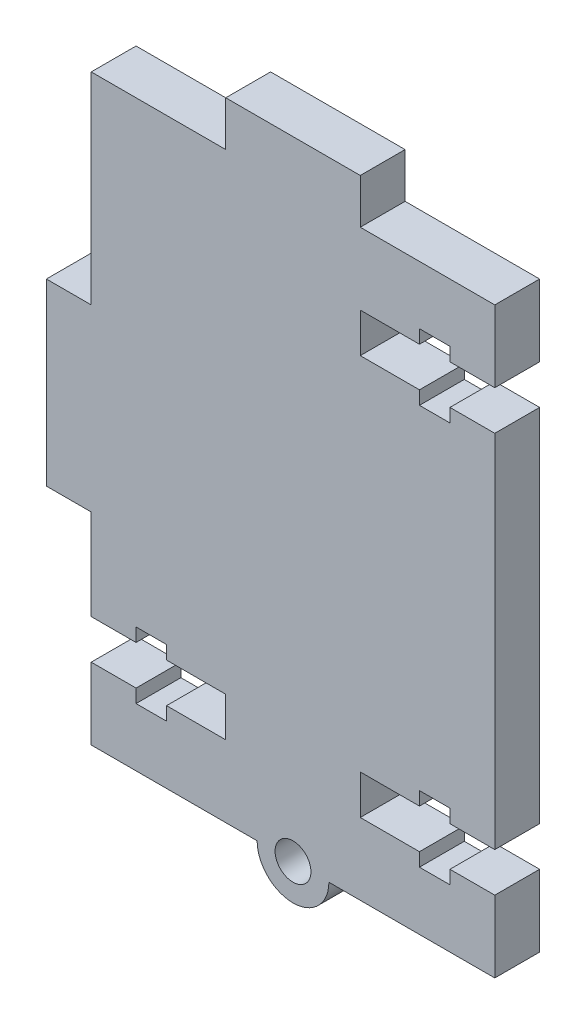
from build123d import *

# Parameters (mm, degrees)
BOSS_EXTRUDE1_DEPTH = 5
CUT_EXTRUDE1_DEPTH  = 5
SKETCH10_R          = 4
SKETCH10_R_2        = 2
BOSS_EXTRUDE3_DEPTH = 5
SKETCH11_R          = 2
CUT_EXTRUDE3_DEPTH  = 5


with BuildPart() as part:
    # Sketch1 → Boss-Extrude1 (new body)
    with BuildSketch(Plane.XY):
        Polygon((7.5, 32.5), (7.5, 37.5), (-7.5, 37.5), (-7.5, 32.5), (-22.5, 32.5), (-22.5, 10), (-27.5, 10), (-27.5, -10), (-22.5, -10), (-22.5, -32.5), (22.5, -32.5), (22.5, 32.5), align=None)
    extrude(amount=BOSS_EXTRUDE1_DEPTH)

    # Sketch3 → Cut-Extrude1 (cut)
    with BuildSketch(Plane.XY.offset(5)):
        Polygon((22.5, 24.5), (17.5, 24.5), (17.5, 26), (14.1, 26), (14.1, 24.5), (7.5, 24.5), (7.5, 20.1), (14.1, 20.1), (14.1, 18.6), (17.5, 18.6), (17.5, 20.1), (22.5, 20.1), align=None)
        Polygon((22.5, -24.5), (22.5, -20.1), (17.5, -20.1), (17.5, -18.6), (14.1, -18.6), (14.1, -20.1), (7.5, -20.1), (7.5, -24.5), (14.1, -24.5), (14.1, -26), (17.5, -26), (17.5, -24.5), align=None)
        Polygon((-22.5, -24.5), (-17.5, -24.5), (-17.5, -26), (-14.1, -26), (-14.1, -24.5), (-7.5, -24.5), (-7.5, -20.1), (-14.1, -20.1), (-14.1, -18.6), (-17.5, -18.6), (-17.5, -20.1), (-22.5, -20.1), align=None)
    extrude(amount=-CUT_EXTRUDE1_DEPTH, mode=Mode.SUBTRACT)

    # Sketch10 → Boss-Extrude3 (add)
    with BuildSketch(Plane.XY.offset(5)):
        with Locations((0, -32.5)):
            Circle(SKETCH10_R)
        with Locations((0, -32.5)):
            Circle(SKETCH10_R_2, mode=Mode.SUBTRACT)
    extrude(amount=-BOSS_EXTRUDE3_DEPTH)

    # Sketch11 → Cut-Extrude3 (cut)
    with BuildSketch(Plane.XY.offset(5)):
        with Locations((0, -32.5)):
            Circle(SKETCH11_R)
    extrude(amount=-CUT_EXTRUDE3_DEPTH, mode=Mode.SUBTRACT)


solid = part.part
